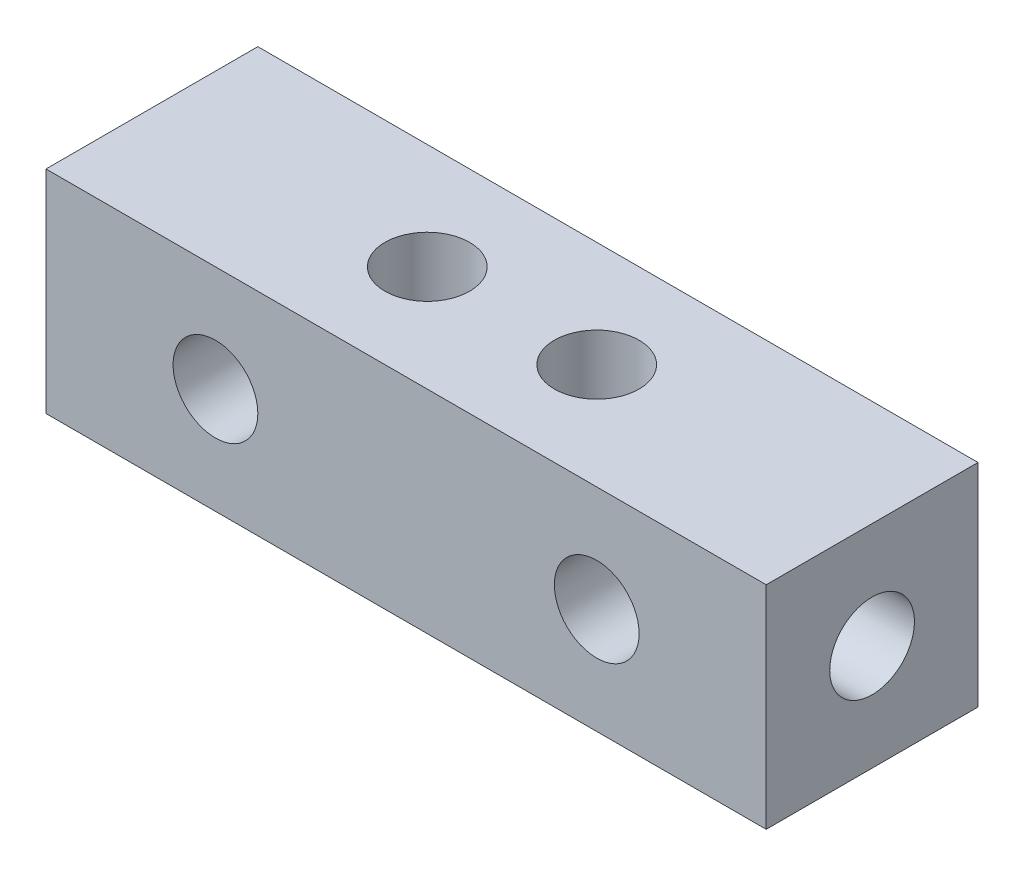
from build123d import *

# Parameters (mm, degrees)
SKETCH_1_W          = 34
SKETCH_1_H          = 10
EXTRUDE_1_DEPTH     = 10
SKETCH_2_R          = 2
CUT_EXTRUDE_1_DEPTH = 10
SKETCH_3_R          = 2
CUT_EXTRUDE_2_DEPTH = 10
SKETCH_4_R          = 2
CUT_EXTRUDE_3_DEPTH = 8


with BuildPart() as part:
    # 草图1 → 凸台-拉伸1 (new body)
    with BuildSketch(Plane(origin=(0, 0, 0), x_dir=(1, 0, 0), z_dir=(0, 1, 0))):
        Rectangle(SKETCH_1_W, SKETCH_1_H)
    extrude(amount=EXTRUDE_1_DEPTH)

    # 草图2 → 切除-拉伸1 (cut)
    with BuildSketch(Plane.XY.offset(5)):
        with Locations((-9, 5)):
            Circle(SKETCH_2_R)
        with Locations((9, 5)):
            Circle(SKETCH_2_R)
    extrude(amount=-CUT_EXTRUDE_1_DEPTH, mode=Mode.SUBTRACT)

    # 草图3 → 切除-拉伸2 (cut)
    with BuildSketch(Plane(origin=(0, 10, 0), x_dir=(1, 0, 0), z_dir=(0, 1, 0))):
        with Locations(Location((-4, 0, 0), (0, 0, 270))):
            Circle(SKETCH_3_R)
        with Locations(Location((4, 0, 0), (0, 0, 270))):
            Circle(SKETCH_3_R)
    extrude(amount=-CUT_EXTRUDE_2_DEPTH, mode=Mode.SUBTRACT)

    # 草图4 → 切除-拉伸3 (cut)
    with BuildSketch(Plane.ZY.offset(17)):
        with Locations((0, 5)):
            Circle(SKETCH_4_R)
    cut_extrude_3 = extrude(amount=-CUT_EXTRUDE_3_DEPTH, mode=Mode.SUBTRACT)

    # 镜向1: 切除-拉伸3 across plane
    add(cut_extrude_3.mirror(Plane(origin=(0, 0, 0), x_dir=(0, 0, 1), z_dir=(1, 0, 0))), mode=Mode.SUBTRACT)


solid = part.part
